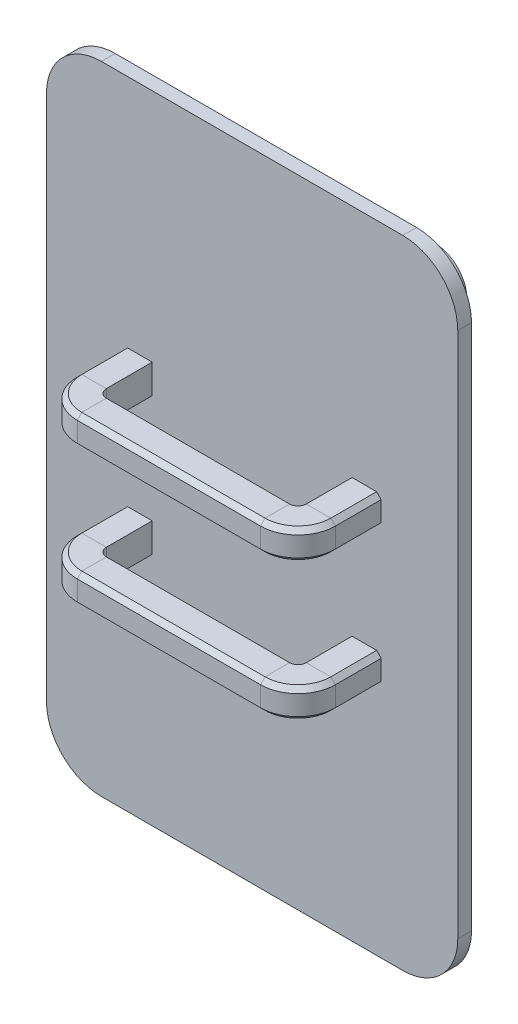
from build123d import *

# Parameters (mm, degrees)
SKETCH1_W                = 79.8
SKETCH1_H                = 129
BOSS_EXTRUDE1_DEPTH      = 4
FILLET1_R                = 7
SKETCH2_R                = 3.325
CUT_EXTRUDE2_DEPTH       = 3.2
BOSS_EXTRUDE3_START      = 3
BOSS_EXTRUDE3_DEPTH      = 3
SKETCH6_W                = 6.35
SKETCH6_H                = 6.35
CHAMFER1_SIZE            = 1
CHAMFER1_OF_MIRROR1_SIZE = 1


with BuildPart() as part:
    # Sketch1 → Boss-Extrude1 (new body)
    with BuildSketch(Plane.XY):
        with Locations((-91.126473502, -25.83334618)):
            Rectangle(SKETCH1_W, SKETCH1_H)
    extrude(amount=BOSS_EXTRUDE1_DEPTH)

    # Fillet1
    fillet1_edges = [part.edges().sort_by_distance(p)[0] for p in [
        (-131.026473502, 38.66665382, 2),
        (-51.226473502, 38.66665382, 2),
        (-51.226473502, -90.33334618, 2),
        (-131.026473502, -90.33334618, 2),
    ]]
    fillet(fillet1_edges, radius=FILLET1_R)

    # Sketch2 → Cut-Extrude2 (cut)
    with BuildSketch(Plane(origin=(0, 0, 0), x_dir=(-1, 0, 0), z_dir=(0, 0, -1))):
        with Locations((55.726473502, 1.91665382)):
            Circle(SKETCH2_R)
        with Locations((91.126473502, 34.16665382)):
            Circle(SKETCH2_R)
        with Locations((55.726473502, -56.58334618)):
            Circle(SKETCH2_R)
        with Locations((91.126473502, -85.83334618)):
            Circle(SKETCH2_R)
        with Locations((126.526473502, 1.91665382)):
            Circle(SKETCH2_R)
        with Locations((126.526473502, -56.58334618)):
            Circle(SKETCH2_R)
    extrude(amount=-CUT_EXTRUDE2_DEPTH, mode=Mode.SUBTRACT)

    # Sketch3 → Boss-Extrude3 (add)
    # profile 1 of 3: a face of its own
    with BuildSketch(Plane.XY.offset(4).offset(BOSS_EXTRUDE3_START)):
        with BuildLine():
            Line((-136.026473502, 31.66665382), (-136.026473502, -83.33334618))
            ThreePointArc((-136.026473502, -83.33334618), (-132.511754876, -91.818627555), (-124.026473502, -95.33334618))
            Line((-124.026473502, -95.33334618), (-58.226473502, -95.33334618))
            ThreePointArc((-58.226473502, -95.33334618), (-49.741192128, -91.818627555), (-46.226473502, -83.33334618))
            Line((-46.226473502, -83.33334618), (-46.226473502, 31.66665382))
            ThreePointArc((-46.226473502, 31.66665382), (-49.741192128, 40.151935194), (-58.226473502, 43.66665382))
            Line((-58.226473502, 43.66665382), (-124.026473502, 43.66665382))
            ThreePointArc((-124.026473502, 43.66665382), (-132.511754876, 40.151935194), (-136.026473502, 31.66665382))
        make_face()
        with BuildLine():
            Line((-124.026473502, -90.33334618), (-58.226473502, -90.33334618))
            ThreePointArc((-58.226473502, -90.33334618), (-53.276726034, -88.283093649), (-51.226473502, -83.33334618))
            Line((-51.226473502, -83.33334618), (-51.226473502, 31.66665382))
            ThreePointArc((-51.226473502, 31.66665382), (-53.276726034, 36.616401288), (-58.226473502, 38.66665382))
            Line((-58.226473502, 38.66665382), (-124.026473502, 38.66665382))
            ThreePointArc((-124.026473502, 38.66665382), (-128.976220971, 36.616401288), (-131.026473502, 31.66665382))
            Line((-131.026473502, 31.66665382), (-131.026473502, -83.33334618))
            ThreePointArc((-131.026473502, -83.33334618), (-128.976220971, -88.283093649), (-124.026473502, -90.33334618))
        make_face(mode=Mode.SUBTRACT)
    # profile 2 of 3: a face of its own
    with BuildSketch(Plane.XY.offset(4).offset(BOSS_EXTRUDE3_START)):
        with BuildLine():
            ThreePointArc((-131.026473502, -83.33334618), (-128.976220971, -88.283093649), (-124.026473502, -90.33334618))
            Line((-124.026473502, -90.33334618), (-58.226473502, -90.33334618))
            ThreePointArc((-58.226473502, -90.33334618), (-53.276726034, -88.283093649), (-51.226473502, -83.33334618))
            Line((-51.226473502, -83.33334618), (-51.226473502, 31.66665382))
            ThreePointArc((-51.226473502, 31.66665382), (-53.276726034, 36.616401288), (-58.226473502, 38.66665382))
            Line((-58.226473502, 38.66665382), (-124.026473502, 38.66665382))
            ThreePointArc((-124.026473502, 38.66665382), (-128.976220971, 36.616401288), (-131.026473502, 31.66665382))
            Line((-131.026473502, 31.66665382), (-131.026473502, -83.33334618))
        make_face()
    # profile 3 of 3: a face of its own
    with BuildSketch(Plane.XY.offset(4).offset(BOSS_EXTRUDE3_START)):
        with BuildLine():
            Line((-124.026473502, -90.33334618), (-58.226473502, -90.33334618))
            ThreePointArc((-58.226473502, -90.33334618), (-53.276726034, -88.283093649), (-51.226473502, -83.33334618))
            Line((-51.226473502, -83.33334618), (-51.226473502, 31.66665382))
            ThreePointArc((-51.226473502, 31.66665382), (-53.276726034, 36.616401288), (-58.226473502, 38.66665382))
            Line((-58.226473502, 38.66665382), (-124.026473502, 38.66665382))
            ThreePointArc((-124.026473502, 38.66665382), (-128.976220971, 36.616401288), (-131.026473502, 31.66665382))
            Line((-131.026473502, 31.66665382), (-131.026473502, -83.33334618))
            ThreePointArc((-131.026473502, -83.33334618), (-128.976220971, -88.283093649), (-124.026473502, -90.33334618))
        make_face()
    extrude(amount=-BOSS_EXTRUDE3_DEPTH)

    # Sweep1: sweep along a curve in space
    with BuildLine() as sweep1_path:
        Line((-116.126473502, -10.83334618, 7), (-116.126473502, -10.83334618, 17))
        ThreePointArc((-116.126473502, -10.83334618, 17), (-114.662007408, -10.83334618, 20.535533906), (-111.126473502, -10.83334618, 22))
        Line((-111.126473502, -10.83334618, 22), (-71.126473502, -10.83334618, 22))
        ThreePointArc((-66.126473502, -10.83334618, 17), (-67.590939596, -10.83334618, 20.535533906), (-71.126473502, -10.83334618, 22))
        Line((-66.126473502, -10.83334618, 17), (-66.126473502, -10.83334618, 7))
    # Sketch6 → Sweep1 (sweep)
    with BuildSketch(Plane.XY.offset(7)):
        with Locations((-116.126473502, -10.83334618)):
            Rectangle(SKETCH6_W, SKETCH6_H)
    sweep1 = sweep(path=sweep1_path.line)

    # Chamfer1
    chamfer1_edges = [part.edges().sort_by_distance(p)[0] for p in [
        (-119.301473502, -14.00834618, 12),
        (-119.301473502, -7.65834618, 12),
        (-116.907071438, -14.00834618, 22.780597936),
        (-116.907071438, -7.65834618, 22.780597936),
        (-91.126473502, -14.00834618, 25.175),
        (-91.126473502, -7.65834618, 25.175),
        (-65.345875566, -14.00834618, 22.780597936),
        (-65.345875566, -7.65834618, 22.780597936),
        (-62.951473502, -14.00834618, 12),
        (-62.951473502, -7.65834618, 12),
    ]]
    chamfer(chamfer1_edges, length=CHAMFER1_SIZE)

    # Mirror1: Sweep1 across plane
    add(sweep1.mirror(Plane.ZX.offset(-25.83334618)))

    # Chamfer1 of Mirror1
    chamfer1_of_mirror1_edges = [part.edges().sort_by_distance(p)[0] for p in [
        (-119.301473502, -37.65834618, 12),
        (-119.301473502, -44.00834618, 12),
        (-116.907071438, -37.65834618, 22.780597936),
        (-116.907071438, -44.00834618, 22.780597936),
        (-91.126473502, -37.65834618, 25.175),
        (-91.126473502, -44.00834618, 25.175),
        (-65.345875566, -37.65834618, 22.780597936),
        (-65.345875566, -44.00834618, 22.780597936),
        (-62.951473502, -37.65834618, 12),
        (-62.951473502, -44.00834618, 12),
    ]]
    chamfer(chamfer1_of_mirror1_edges, length=CHAMFER1_OF_MIRROR1_SIZE)


solid = part.part
